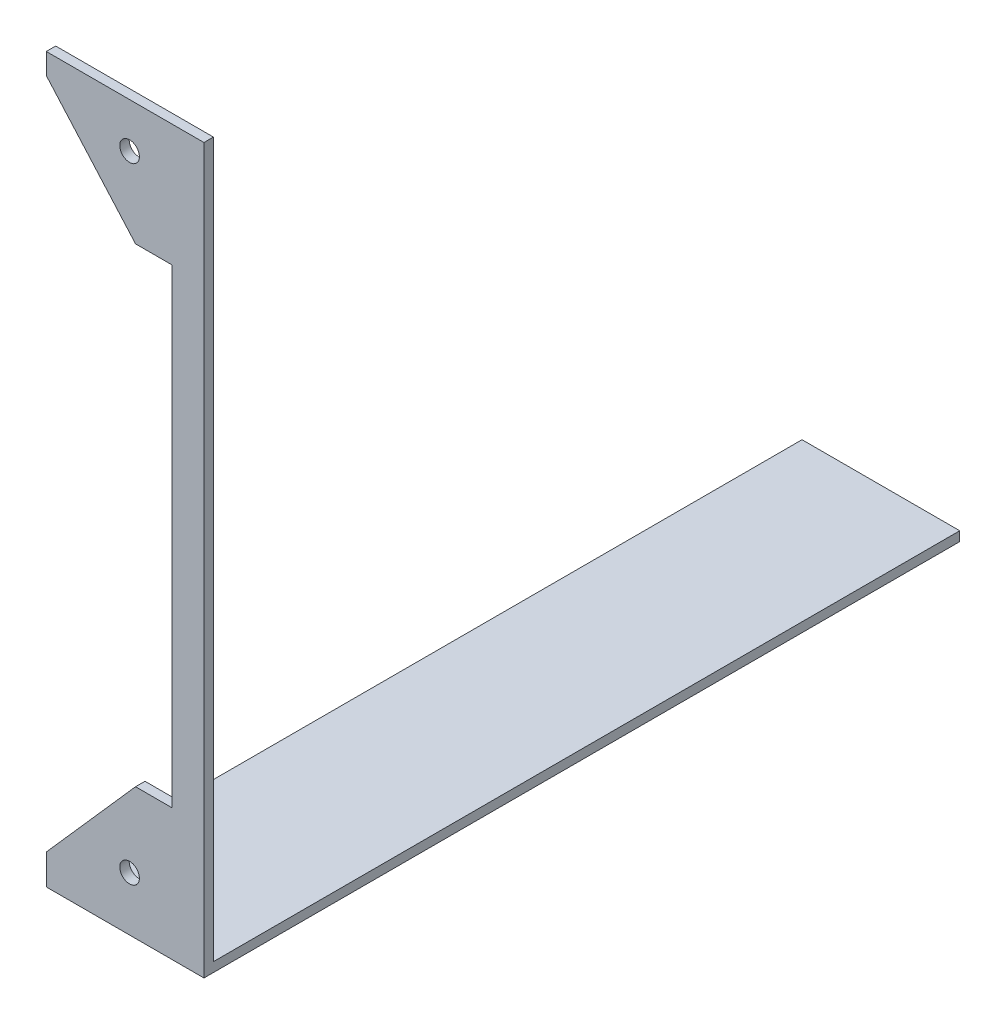
from build123d import *

# Parameters (mm, degrees)
BOSS_EXTRUDE1_DEPTH = 1.5875
SKETCH2_W           = 26.5
SKETCH2_H           = 127
BOSS_EXTRUDE2_DEPTH = 1.5875


with BuildPart() as part:
    # Sketch1 → Boss-Extrude1 (new body)
    with BuildSketch(Plane.XY):
        Polygon((-26.5, 120), (0, 120), (0, 0), (-26.5, 0), (-26.5, 3.5), (-11.5, 20.5), (-5.4, 20.5), (-5.4, 99.5), (-11.5, 99.5), (-26.5, 116.5), align=None)
        with BuildLine():
            ThreePointArc((-14.15, 112.5), (-12.5, 110.85), (-10.85, 112.5))
            ThreePointArc((-10.85, 112.5), (-12.5, 114.15), (-14.15, 112.5))
        make_face(mode=Mode.SUBTRACT)
        with BuildLine():
            ThreePointArc((-14.15, 7.5), (-12.5, 5.85), (-10.85, 7.5))
            ThreePointArc((-10.85, 7.5), (-12.5, 9.15), (-14.15, 7.5))
        make_face(mode=Mode.SUBTRACT)
    extrude(amount=BOSS_EXTRUDE1_DEPTH)

    # Sketch2 → Boss-Extrude2 (add)
    with BuildSketch(Plane(origin=(0, 0, 0), x_dir=(1, 0, 0), z_dir=(0, 1, 0))):
        with Locations((-13.25, 61.9125)):
            Rectangle(SKETCH2_W, SKETCH2_H)
    extrude(amount=-BOSS_EXTRUDE2_DEPTH)


solid = part.part
